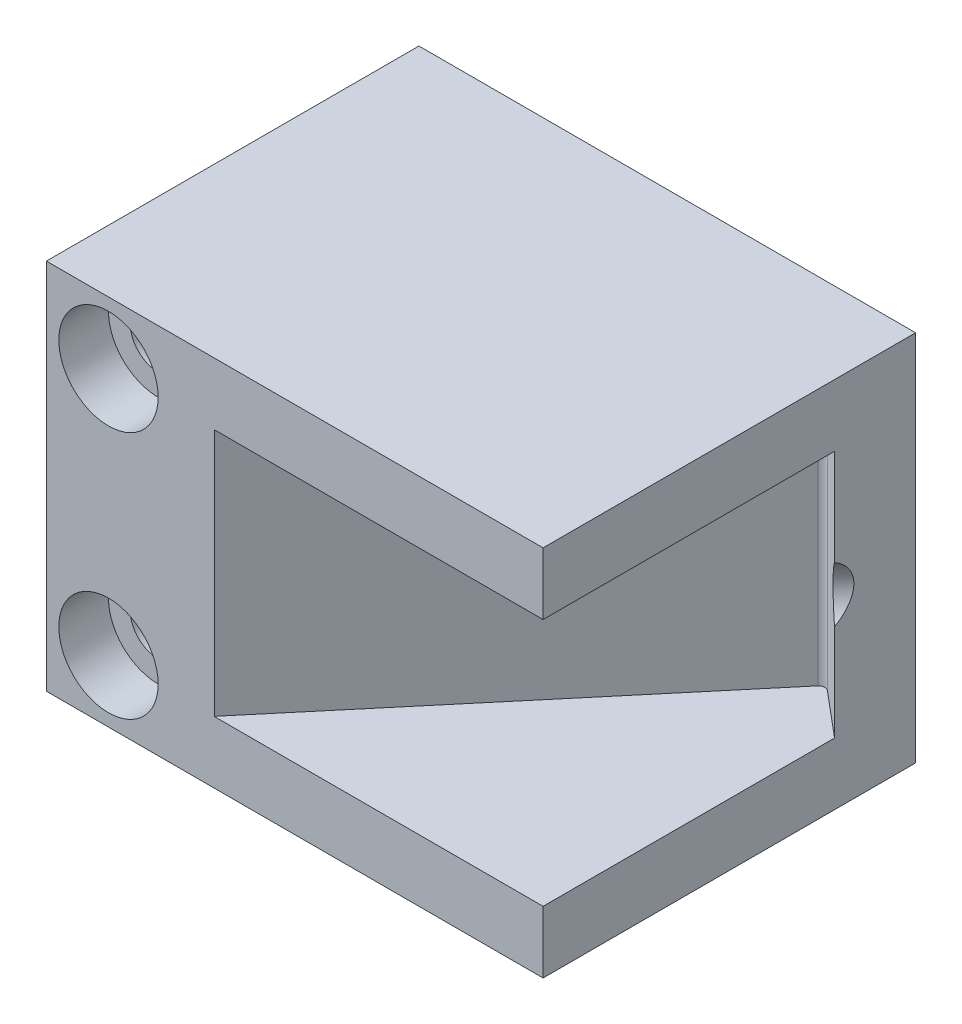
from build123d import *

# Parameters (mm, degrees)
SKETCH_1_W                   = 40
SKETCH_1_H                   = 30
EXTRUDE_1_DEPTH              = 15
SKETCH_4_W                   = 35
SKETCH_4_H                   = 20
CUT_EXTRUDE_1_DEPTH          = 34.23784159
FILLET_1_R                   = 0.5
CUT_EXTRUDE_4_DEPTH          = 4
HOLE_WIZARD_M4_2_D           = 4.5
HOLE_WIZARD_M4_2_CBORE_D     = 8
HOLE_WIZARD_M4_2_CBORE_DEPTH = 4


with BuildPart() as part:
    # 草圖1 → 填料-伸長1 (new, symmetric)
    with BuildSketch(Plane.XY):
        Rectangle(SKETCH_1_W, SKETCH_1_H)
    extrude(amount=EXTRUDE_1_DEPTH, both=True)

    # 草圖4 → 除料-伸長1 (cut, through all)
    with BuildSketch(Plane(origin=(3.574759116, 0, 2.999579055), x_dir=(-0.6427876096865437, 0, 0.7660444431189745), z_dir=(0.7660444431189745, 0, 0.6427876096865437))):
        with Locations((-1.846418841, 0)):
            Rectangle(SKETCH_4_W, SKETCH_4_H)
    extrude(amount=CUT_EXTRUDE_1_DEPTH, mode=Mode.SUBTRACT)

    # 圓角1
    fillet_1_edges = [part.edges().sort_by_distance(p)[0] for p in [
        (16.010397438, 0, -11.820637592),
    ]]
    fillet(fillet_1_edges, radius=FILLET_1_R)

    # 草圖7 → 除料-伸長4 (cut)
    with BuildSketch(Plane(origin=(12.435638322, 0, -14.820216647), x_dir=(0.7660444431189746, 0, 0.6427876096865437), z_dir=(-0.6427876096865437, 0, 0.7660444431189746))):
        with BuildLine():
            Line((9.874572873, -2.236067977), (9.874572873, 2.236067977))
            ThreePointArc((9.874572873, 2.236067977), (8.874572873, 0), (9.874572873, -2.236067977))
        make_face()
    extrude(amount=-CUT_EXTRUDE_4_DEPTH, mode=Mode.SUBTRACT)

    # M4 凹頭蓋螺釘的柱孔2 (through all)
    with Locations(Plane.XY.offset(15)):
        with Locations((-15, 10), (-15, -10)):
            CounterBoreHole(HOLE_WIZARD_M4_2_D / 2, HOLE_WIZARD_M4_2_CBORE_D / 2, HOLE_WIZARD_M4_2_CBORE_DEPTH)


solid = part.part
